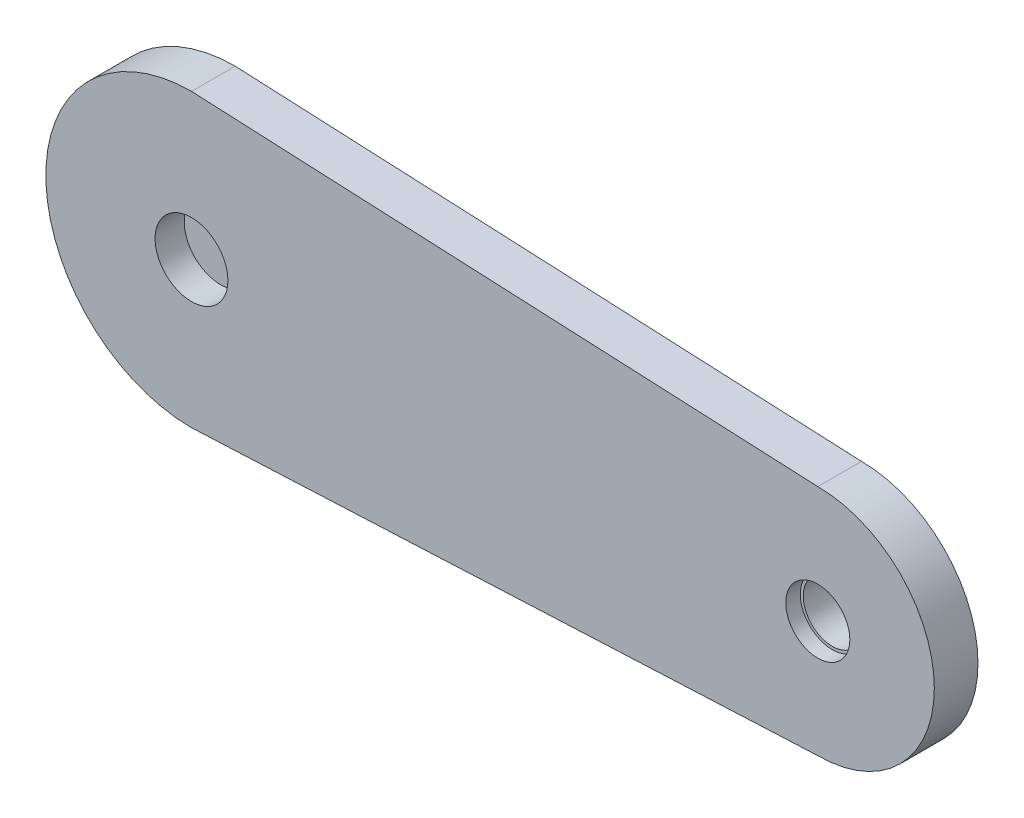
from build123d import *

# Parameters (mm, degrees)
CROQUIS1_R              = 1.25
CROQUIS1_R_2            = 10
SALIENTE_EXTRUIR1_DEPTH = 15
CROQUIS2_R              = 12.5
CORTAR_EXTRUIR1_DEPTH   = 10
CROQUIS3_R              = 11
CORTAR_EXTRUIR2_DEPTH   = 5


with BuildPart() as part:
    # Croquis1 → Saliente-Extruir1 (new body)
    with BuildSketch(Plane.XY):
        with BuildLine():
            Line((0, 50), (215, 40))
            ThreePointArc((215, 40), (255, 0), (215, -40))
            Line((215, -40), (4.641122504, -49.784133837))
            ThreePointArc((4.641122504, -49.784133837), (-49.946004304, -2.323069968), (0, 50))
        make_face()
        Circle(CROQUIS1_R, mode=Mode.SUBTRACT)
        with Locations((215, 0)):
            Circle(CROQUIS1_R_2, mode=Mode.SUBTRACT)
    extrude(amount=SALIENTE_EXTRUIR1_DEPTH)

    # Croquis2 → Cortar-Extruir1 (cut)
    with BuildSketch(Plane.XY.offset(15)):
        Circle(CROQUIS2_R)
    extrude(amount=-CORTAR_EXTRUIR1_DEPTH, mode=Mode.SUBTRACT)

    # Croquis3 → Cortar-Extruir2 (cut)
    with BuildSketch(Plane.XY.offset(15)):
        with Locations((215, 0)):
            Circle(CROQUIS3_R)
    extrude(amount=-CORTAR_EXTRUIR2_DEPTH, mode=Mode.SUBTRACT)


solid = part.part
